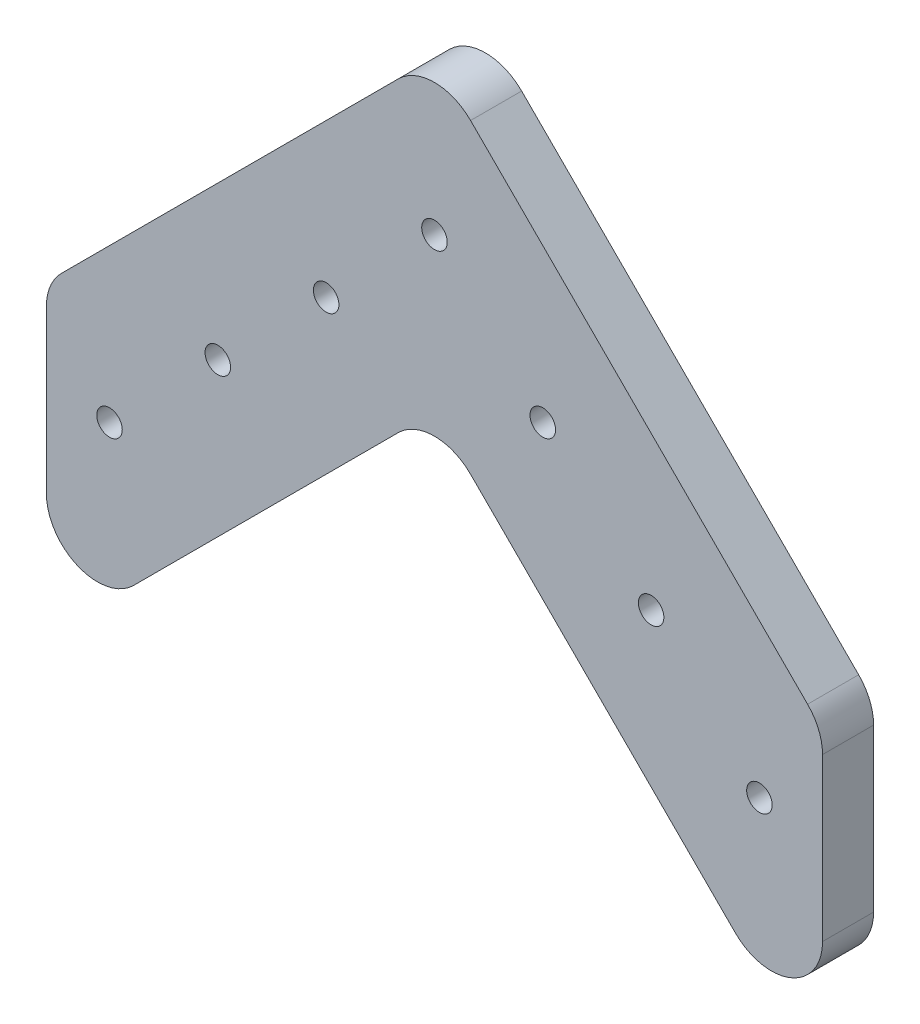
from build123d import *

# Parameters (mm, degrees)
SKETCH1_R           = 1.25
BOSS_EXTRUDE1_DEPTH = 5
FILLET1_R           = 5


with BuildPart() as part:
    # Sketch1 → Boss-Extrude1 (new body)
    with BuildSketch(Plane.XY):
        Polygon((-38, 74.828427125), (0, 112.828427125), (38, 74.828427125), (38, 104.828427125), (0, 142.828427125), (-38, 104.828427125), align=None)
        with Locations((-31.819805153, 96.008621971)):
            Circle(SKETCH1_R, mode=Mode.SUBTRACT)
        with Locations((-21.213203436, 106.615223689)):
            Circle(SKETCH1_R, mode=Mode.SUBTRACT)
        with Locations((-10.606601718, 117.221825407)):
            Circle(SKETCH1_R, mode=Mode.SUBTRACT)
        with Locations((0, 127.828427125)):
            Circle(SKETCH1_R, mode=Mode.SUBTRACT)
        with Locations(Location((10.606601718, 117.221825407, 0), (0, 0, 180))):
            Circle(SKETCH1_R, mode=Mode.SUBTRACT)
        with Locations(Location((21.213203436, 106.615223689, 0), (0, 0, 180))):
            Circle(SKETCH1_R, mode=Mode.SUBTRACT)
        with Locations(Location((31.819805153, 96.008621971, 0), (0, 0, 180))):
            Circle(SKETCH1_R, mode=Mode.SUBTRACT)
    extrude(amount=BOSS_EXTRUDE1_DEPTH)

    # Fillet1
    fillet1_edges = [part.edges().sort_by_distance(p)[0] for p in [
        (-38, 104.828427125, 2.5),
        (0, 142.828427125, 2.5),
        (38, 104.828427125, 2.5),
        (38, 74.828427125, 2.5),
        (0, 112.828427125, 2.5),
        (-38, 74.828427125, 2.5),
    ]]
    fillet(fillet1_edges, radius=FILLET1_R)


solid = part.part
